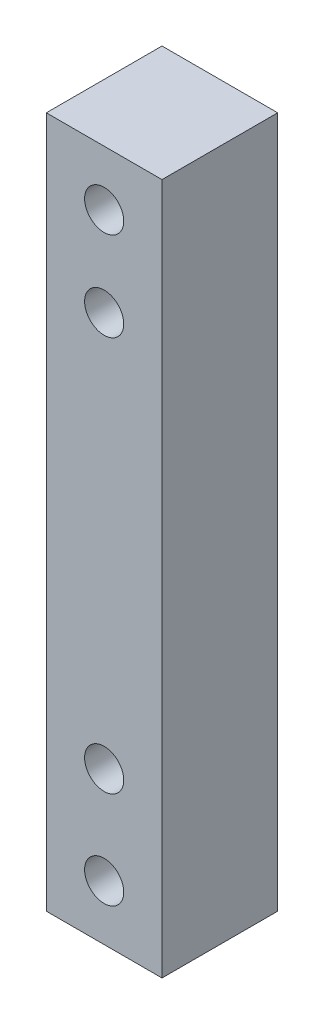
from build123d import *

# Parameters (mm, degrees)
SKETCH1_W           = 13
SKETCH1_H           = 77.7
SKETCH1_R           = 2.2
BOSS_EXTRUDE1_DEPTH = 13


with BuildPart() as part:
    # Sketch1 → Boss-Extrude1 (new body)
    with BuildSketch(Plane.XY):
        with Locations((-27, -166.950035894)):
            Rectangle(SKETCH1_W, SKETCH1_H)
        with Locations((-27, -134.300035894)):
            Circle(SKETCH1_R, mode=Mode.SUBTRACT)
        with Locations((-27, -144.300035894)):
            Circle(SKETCH1_R, mode=Mode.SUBTRACT)
        with Locations((-27, -199.600035894)):
            Circle(SKETCH1_R, mode=Mode.SUBTRACT)
        with Locations((-27, -188.700035894)):
            Circle(SKETCH1_R, mode=Mode.SUBTRACT)
    extrude(amount=-BOSS_EXTRUDE1_DEPTH)


solid = part.part
